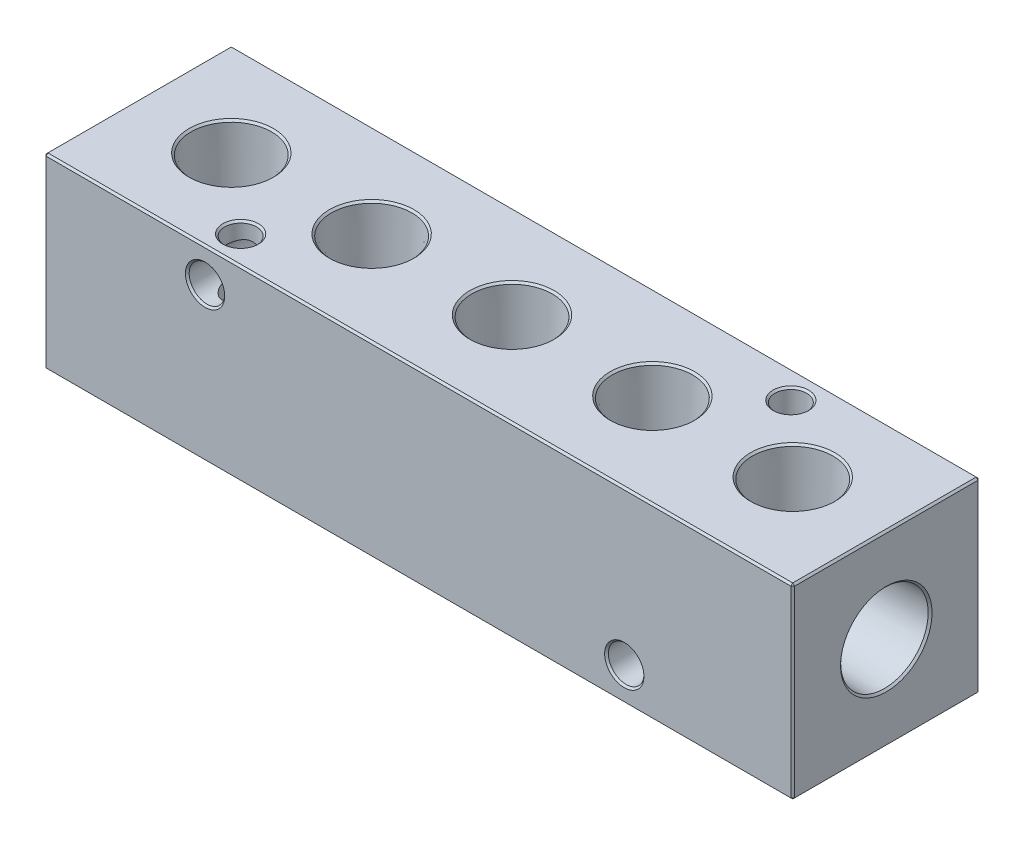
from build123d import *
from OCP.BRepFilletAPI import BRepFilletAPI_MakeChamfer

# Parameters (mm, degrees)
SKETCH1_W           = 25.4
SKETCH1_H           = 25.4
SKETCH1_R           = 5.5753
BOSS_EXTRUDE1_DEPTH = 50.8
LPATTERN1_COUNT     = 5
LPATTERN1_PITCH     = 19.05
SKETCH4_R           = 2.159
CUT_EXTRUDE1_DEPTH  = 59.198711413
SKETCH5_R           = 2.413
CUT_EXTRUDE2_DEPTH  = 59.198711435
CHAMFER1_SIZE       = 0.254
CHAMFER1_SIZE2      = 0.26232149


with BuildPart() as part:
    # Sketch1 → Boss-Extrude1 (new, symmetric)
    with BuildSketch(Plane(origin=(0, 0, 0), x_dir=(0, 0, -1), z_dir=(1, 0, 0))):
        Rectangle(SKETCH1_W, SKETCH1_H)
        Circle(SKETCH1_R, mode=Mode.SUBTRACT)
    extrude(amount=BOSS_EXTRUDE1_DEPTH, both=True)

    # Sketch2 → Cut-Revolve1 (revolve, cut)
    with BuildSketch(Plane.XY, mode=Mode.PRIVATE) as cut_revolve1_sk:
        Polygon((-38.1, 12.7), (-38.1, 0), (-43.18, 0), (-43.576872646, 12.7), align=None)
    cut_revolve1 = revolve(cut_revolve1_sk.sketch.rotate(Axis((-38.1, 12.7, 0), (0, -1, 0)), 270), axis=Axis((-38.1, 12.7, 0), (0, -1, 0)), mode=Mode.SUBTRACT)

    # LPattern1: Cut-Revolve1 ×5
    with Locations(*[(i * LPATTERN1_PITCH, 0, 0) for i in range(1, LPATTERN1_COUNT)]):
        add(cut_revolve1, mode=Mode.SUBTRACT)

    # Sketch3 → Cut-Revolve2 (revolve, cut)
    with BuildSketch(Plane.XY, mode=Mode.PRIVATE) as cut_revolve2_sk:
        Polygon((-50.8, 5.944311727), (-36.5125, 5.49783), (-36.5125, 0), (-50.8, 0), align=None)
        Polygon((50.8, 5.944311727), (36.5125, 5.49783), (36.5125, 0), (50.8, 0), align=None)
    revolve(cut_revolve2_sk.sketch.rotate(Axis((-36.5125, 0, 0), (1, 0, 0)), 65.528264724), axis=Axis((-36.5125, 0, 0), (1, 0, 0)), mode=Mode.SUBTRACT)

    # Sketch4 → Cut-Extrude1 (cut, through all)
    with BuildSketch(Plane(origin=(0, 12.7, 0), x_dir=(1, 0, 0), z_dir=(0, 1, 0))):
        with Locations(Location((-27.94, -8.89, 0), (0, 0, 270))):
            Circle(SKETCH4_R)
        with Locations(Location((28.956, 8.89, 0), (0, 0, 270))):
            Circle(SKETCH4_R)
    extrude(amount=-CUT_EXTRUDE1_DEPTH, mode=Mode.SUBTRACT)

    # Sketch5 → Cut-Extrude2 (cut, through all)
    with BuildSketch(Plane.XY.offset(12.7)):
        with Locations((-28.956, 8.128)):
            Circle(SKETCH5_R)
        with Locations((27.94, -8.128)):
            Circle(SKETCH5_R)
    extrude(amount=-CUT_EXTRUDE2_DEPTH, mode=Mode.SUBTRACT)

    # Chamfer1: one chamfer whose edges measure the first distance from different faces: ONE call of the kernel's chamfer builder (chamfer() names one face for all edges)
    chamfer1_edges_1 = [part.edges().sort_by_distance(p)[0] for p in [
        (50.8, 0, -12.7),
        (50.8, 12.7, 0),
        (50.8, 0, 12.7),
        (-50.8, 12.7, 0),
        (-50.8, 0, -12.7),
        (-50.8, -12.7, 0),
        (-27.94, -12.7, 6.731),
        (-27.94, 12.7, 6.731),
        (-50.8, 0, 12.7),
        (28.956, -12.7, -11.049),
        (28.956, 12.7, -11.049),
        (-31.369, 8.128, -12.7),
        (-31.369, 8.128, 12.7),
        (25.527, -8.128, -12.7),
        (25.527, -8.128, 12.7),
        (50.8, -12.7, 0),
        (0, 12.7, 12.7),
        (0, 12.7, -12.7),
        (0, -12.7, -12.7),
        (0, -12.7, 12.7),
    ]]
    chamfer1_edges_2 = [part.edges().sort_by_distance(p)[0] for p in [
        (-38.1, 12.7, -5.476872646),
        (-19.05, 12.7, -5.476872646),
        (0, 12.7, -5.476872646),
        (19.05, 12.7, -5.476872646),
        (38.1, 12.7, -5.476872646),
    ]]
    chamfer1_side_2 = [part.faces().sort_by_distance(p)[0] for p in [
        (-49.752731171, 12.7, 0),
    ]]
    chamfer1_edges_3 = [part.edges().sort_by_distance(p)[0] for p in [
        (-50.8, -2.462397232, -5.410308843),
    ]]
    chamfer1_side_3 = [part.faces().sort_by_distance(p)[0] for p in [
        (-50.8, -12.340789755, 0),
    ]]
    chamfer1_edges_4 = [part.edges().sort_by_distance(p)[0] for p in [
        (50.8, -2.462397232, -5.410308843),
    ]]
    chamfer1_side_4 = [part.faces().sort_by_distance(p)[0] for p in [
        (44.895777269, -2.385966729, -5.242377926),
    ]]
    chamfer1 = BRepFilletAPI_MakeChamfer(part.part.solid().wrapped)
    for e in chamfer1_edges_1:
        chamfer1.Add(CHAMFER1_SIZE, e.wrapped)
    for e in chamfer1_edges_2:
        chamfer1.Add(CHAMFER1_SIZE, CHAMFER1_SIZE2, e.wrapped, chamfer1_side_2[0].wrapped)  # the first distance lies on this face
    for e in chamfer1_edges_3:
        chamfer1.Add(CHAMFER1_SIZE, CHAMFER1_SIZE2, e.wrapped, chamfer1_side_3[0].wrapped)  # the first distance lies on this face
    for e in chamfer1_edges_4:
        chamfer1.Add(CHAMFER1_SIZE, CHAMFER1_SIZE2, e.wrapped, chamfer1_side_4[0].wrapped)  # the first distance lies on this face
    add(Compound.cast(chamfer1.Shape()), mode=Mode.REPLACE)


solid = part.part
